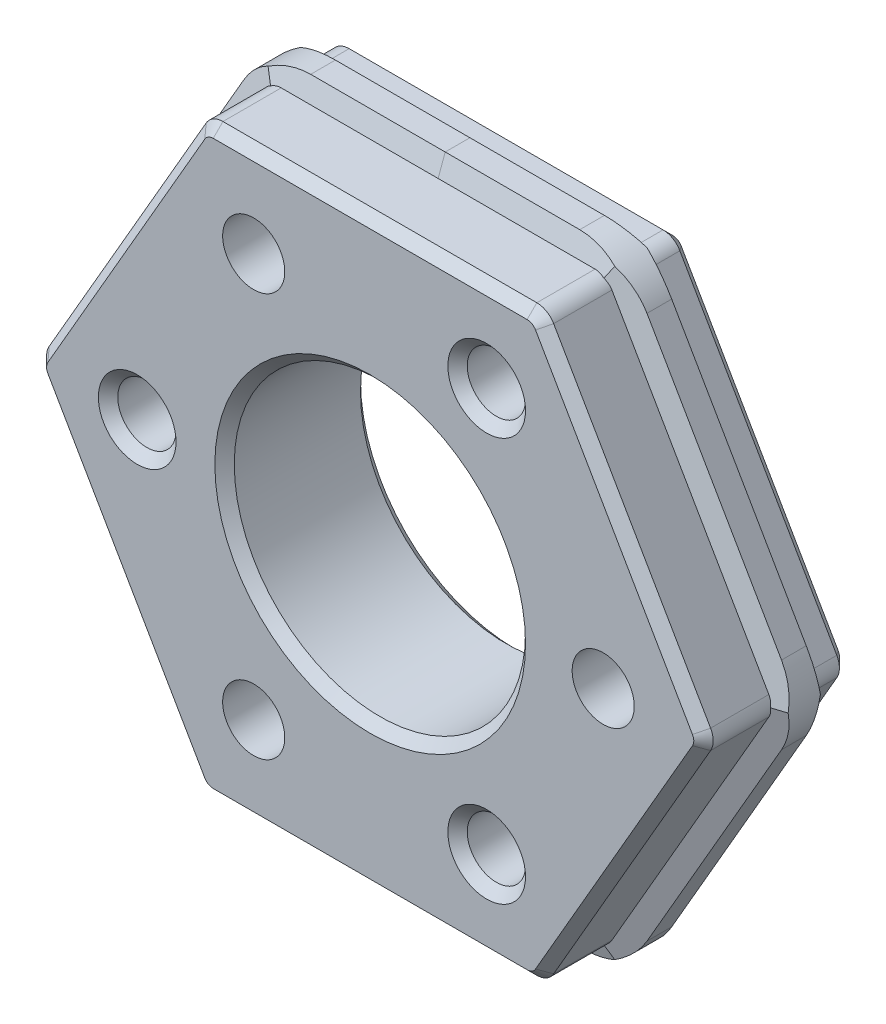
from build123d import *

# Parameters (mm, degrees)
SKETCH_1_W                   = 32
SKETCH_1_H                   = 32
SKETCH_1_R                   = 7.5
EXTRUDE_1_DEPTH              = 3
SKETCH_23_W                  = 32
SKETCH_23_H                  = 32
SKETCH_23_R                  = 7.5
EXTRUDE_4_DEPTH              = 1.5
HOLE_WIZARD_M3_1_D           = 3.2
HOLE_WIZARD_M3_1_CBORE_D     = 5.7
HOLE_WIZARD_M3_1_CBORE_DEPTH = 5
F_3_0MM_1_D                  = 3
F_3_0MM_1_DEPTH              = 4
F_3_0MM_1_TIP                = 0.9012909285413404
SKETCH_26_OUTSIDE_W          = 43.174
SKETCH_26_OUTSIDE_H          = 43.174
SKETCH_26_OUTSIDE_R          = 15
CUT_EXTRUDE_1_DEPTH          = 24.837994882120434
EXTRUDE_5_DEPTH              = 7.5
FILLET_1_R                   = 1
CHAMFER_1_SIZE               = 0.5
FILLET_2_R                   = 4


with BuildPart() as part:
    # 草图1 → 凸台-拉伸1 (new, symmetric)
    with BuildSketch(Plane.XY):
        Rectangle(SKETCH_1_W, SKETCH_1_H)
        Circle(SKETCH_1_R, mode=Mode.SUBTRACT)
    extrude(amount=EXTRUDE_1_DEPTH, both=True)

    # 草图23 → 凸台-拉伸4 (add)
    with BuildSketch(Plane.XY.offset(3)):
        Rectangle(SKETCH_23_W, SKETCH_23_H)
        Circle(SKETCH_23_R, mode=Mode.SUBTRACT)
    extrude(amount=EXTRUDE_4_DEPTH)

    # M3 六角圆柱头螺钉的柱形沉头孔1 (through all)
    with Locations(Plane(origin=(0, 0, -3), x_dir=(-1, 0, 0), z_dir=(0, 0, -1))):
        with Locations((-12, 0), (6, 10.392304845), (6, -10.392304845)):
            CounterBoreHole(HOLE_WIZARD_M3_1_D / 2, HOLE_WIZARD_M3_1_CBORE_D / 2, HOLE_WIZARD_M3_1_CBORE_DEPTH)

    # Ø3.0mm 暗销孔1
    with Locations(Plane.XY.offset(4.500000000000001)):
        with Locations((-12, 0), (6, 10.392304845), (6, -10.392304845)):
            Hole(F_3_0MM_1_D / 2, depth=F_3_0MM_1_DEPTH)
            with Locations((0, 0, -(F_3_0MM_1_DEPTH + F_3_0MM_1_TIP / 2))):  # 118° drill point
                Cone(0, F_3_0MM_1_D / 2, F_3_0MM_1_TIP, mode=Mode.SUBTRACT)

    # 草图26 outside → 切除-拉伸1 (cut, through all)
    with BuildSketch(Plane(origin=(0, 0, -3), x_dir=(-1, 0, 0), z_dir=(0, 0, -1))):
        Rectangle(SKETCH_26_OUTSIDE_W, SKETCH_26_OUTSIDE_H)
        Circle(SKETCH_26_OUTSIDE_R, mode=Mode.SUBTRACT)
    extrude(amount=-CUT_EXTRUDE_1_DEPTH, mode=Mode.SUBTRACT)

    # 草图42 → 凸台-拉伸5 (add)
    with BuildSketch(Plane(origin=(0, 0, -3), x_dir=(-1, 0, 0), z_dir=(0, 0, -1))):
        with BuildLine():
            Line((-12.990381096299085, 7.499999931527694), (-17.32050807568877, 0))
            Line((-17.32050807568877, 0), (-12.99038117476846, -7.4999997956147455))
            ThreePointArc((-12.990381174768459, -7.499999795614747), (-15, 7.84693795e-08), (-12.990381096299085, 7.499999931527694))
        make_face()
        with BuildLine():
            ThreePointArc((-3.268098068e-08, -15), (-7.500000116343906, -12.990380989595394), (-12.990381174768459, -7.499999795614747))
            Line((-12.99038117476846, -7.4999997956147455), (-8.660254037844386, -15))
            Line((-8.660254037844386, -15), (-3.268098148e-08, -15))
        make_face()
        with BuildLine():
            Line((-8.660254037844389, 15), (-12.990381096299085, 7.499999931527694))
            ThreePointArc((-12.990381096299085, 7.499999931527694), (-7.500000044953584, 12.990381030812616), (-2.475085045e-08, 15))
            Line((-2.475085026e-08, 15), (-8.660254037844389, 15))
        make_face()
        with BuildLine():
            ThreePointArc((12.990381096299007, -7.499999931527828), (7.500000020084812, -12.990381045170608), (-3.268098068e-08, -15))
            Line((-3.268098148e-08, -15), (8.660254037844389, -15.000000000000002))
            Line((8.660254037844389, -15.000000000000002), (12.990381096299007, -7.499999931527833))
        make_face()
        with BuildLine():
            Line((8.660254037844386, 15.000000000000002), (-2.475085026e-08, 15))
            ThreePointArc((-2.475084712e-08, 15), (7.499999977454134, 12.990381069783442), (12.990381043108282, 7.500000023656865))
            Line((12.990381043108282, 7.500000023656862), (8.660254037844386, 15.000000000000002))
        make_face()
        with BuildLine():
            ThreePointArc((12.990381043108284, 7.500000023656865), (15, 5.319072383e-08), (12.990381096299007, -7.499999931527828))
            Line((12.990381096299007, -7.499999931527833), (17.320508075688775, -5.33e-15))
            Line((17.320508075688775, -5.2e-15), (12.990381043108282, 7.500000023656862))
        make_face()
    extrude(amount=-EXTRUDE_5_DEPTH)

    # 扫描1: sweep along a path in 草图44
    with BuildLine(Plane(origin=(0, 0, -1), x_dir=(-1, 0, 0), z_dir=(0, 0, -1))) as sweep_1_path:
        Line((-8.660254037844389, 15.000000000000002), (-17.32050807568877, -1.73e-15))
        Line((-17.32050807568877, -1.73e-15), (-8.660254037844387, -15))
        Line((-8.660254037844387, -15), (8.660254037844389, -15.000000000000004))
        Line((8.660254037844389, -15.000000000000004), (17.320508075688775, -6.07e-15))
        Line((17.320508075688775, -6.07e-15), (8.660254037844387, 15))
        Line((8.660254037844387, 15), (-8.660254037844389, 15.000000000000002))
    # 草图43 → 扫描1 (sweep)
    with BuildSketch(Plane(origin=(0, 0, 0), x_dir=(0, 0, -1), z_dir=(1, 0, 0))):
        Polygon((-0.9999999999999974, 15.000000000000002), (1, 15.000000000000002), (0.6360297657338008, 16), (-0.6360297657337987, 16), align=None)
    sweep(path=sweep_1_path.line, transition=Transition.RIGHT)

    # 圆角1
    fillet_1_edges = [part.edges().sort_by_distance(p)[0] for p in [
        (-8.660254037844386, 15.000000000000002, 2.7499999999999982),
        (-17.320508075688775, -5.27e-15, 2.7499999999999982),
        (-8.660254037844389, -15.000000000000002, 2.7499999999999982),
        (8.660254037844386, -15, 2.7499999999999982),
        (17.32050807568877, 0, 2.7499999999999982),
        (17.32050807568877, 0, -2),
        (8.660254037844386, -15, -2),
        (-8.660254037844389, -15.000000000000002, -2),
        (-17.320508075688775, -5.27e-15, -2),
        (-8.660254037844386, 15.000000000000002, -2),
        (8.660254037844389, 15, -2),
        (8.660254037844389, 15, 2.7499999999999982),
    ]]
    fillet(fillet_1_edges, radius=FILLET_1_R)

    # 倒角1
    chamfer_1_edges = [part.edges().sort_by_distance(p)[0] for p in [
        (-7.5, 4.25e-15, -3),
        (3.55e-15, 15, 4.5),
        (12.99038105676658, 7.5, 4.5),
        (12.990381056766578, -7.5, 4.5),
        (-12.99038105676658, 7.5, 4.5),
        (-12.990381056766584, -7.500000000000003, 4.5),
        (-1.78e-15, -15, 4.5),
        (-17.165807537309526, -4.64e-15, 4.5),
        (-8.582903768654763, -14.866025403784437, 4.5),
        (8.58290376865476, -14.86602540378444, 4.5),
        (-8.582903768654756, 14.866025403784443, 4.5),
        (17.16580753730952, 1.09e-15, 4.5),
        (-7.5, 4.25e-15, 4.5),
        (8.582903768654763, 14.866025403784437, 4.5),
        (3.55e-15, 15, -3),
        (12.99038105676658, 7.5, -3),
        (12.990381056766578, -7.5, -3),
        (-1.78e-15, -15, -3),
        (-12.990381056766584, -7.500000000000003, -3),
        (-12.99038105676658, 7.5, -3),
        (-17.165807537309526, -4.64e-15, -3),
        (-8.582903768654763, -14.86602540378444, -3),
        (8.58290376865476, -14.866025403784437, -3),
        (-8.582903768654756, 14.866025403784443, -3),
        (17.16580753730952, 1.11e-15, -3),
        (8.582903768654763, 14.866025403784437, -3),
        (7.5, -10.392304845, 4.5),
        (7.5, 10.392304845, 4.5),
        (-10.5, 1.8e-16, 4.5),
    ]]
    chamfer(chamfer_1_edges, length=CHAMFER_1_SIZE)

    # 圆角2
    fillet_2_edges = [part.edges().sort_by_distance(p)[0] for p in [
        (9.237604307034012, -16, -1.11e-15),
        (18.475208614068023, -4.33e-15, -1.11e-15),
        (-9.23760430703402, -16, -1.11e-15),
        (9.23760430703402, 16, -1.11e-15),
        (-18.475208614068023, 3.03e-15, -1.11e-15),
        (-9.23760430703401, 16, -1.11e-15),
    ]]
    fillet(fillet_2_edges, radius=FILLET_2_R)


solid = part.part
